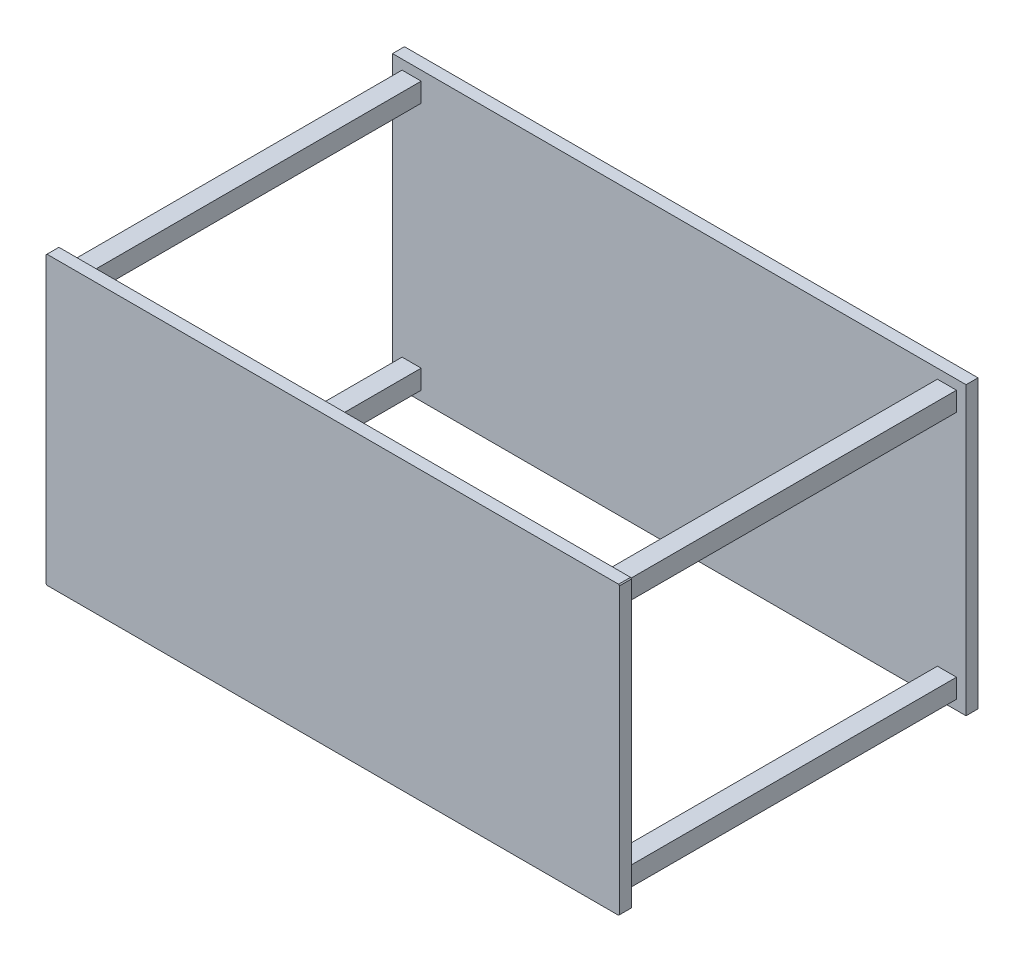
from build123d import *

# Parameters (mm, degrees)
SKETCH1_W           = 1200
SKETCH1_H           = 600
BOSS_EXTRUDE1_DEPTH = 25
SKETCH2_W           = 40
SKETCH2_H           = 40
BOSS_EXTRUDE2_DEPTH = 725
SKETCH3_W           = 1200
SKETCH3_H           = 600
BOSS_EXTRUDE3_DEPTH = 25
CHAMFER1_SIZE       = 2


with BuildPart() as part:
    # Sketch1 → Boss-Extrude1 (new body)
    with BuildSketch(Plane.XY):
        Rectangle(SKETCH1_W, SKETCH1_H)
    extrude(amount=BOSS_EXTRUDE1_DEPTH)

    # Sketch2 → Boss-Extrude2 (add)
    with BuildSketch(Plane.XY):
        with Locations((-560, -260)):
            Rectangle(SKETCH2_W, SKETCH2_H)
        with Locations((560, -260)):
            Rectangle(SKETCH2_W, SKETCH2_H)
        with Locations((560, 260)):
            Rectangle(SKETCH2_W, SKETCH2_H)
        with Locations((-560, 260)):
            Rectangle(SKETCH2_W, SKETCH2_H)
    extrude(amount=BOSS_EXTRUDE2_DEPTH)

    # Sketch3 → Boss-Extrude3 (add)
    with BuildSketch(Plane.XY.offset(725)):
        Rectangle(SKETCH3_W, SKETCH3_H)
    extrude(amount=BOSS_EXTRUDE3_DEPTH)

    # Chamfer1
    chamfer1_edges = [part.edges().sort_by_distance(p)[0] for p in [
        (600, -300, 737.5),
        (600, 300, 737.5),
        (-600, 300, 737.5),
        (-600, -300, 737.5),
    ]]
    chamfer(chamfer1_edges, length=CHAMFER1_SIZE)


solid = part.part
